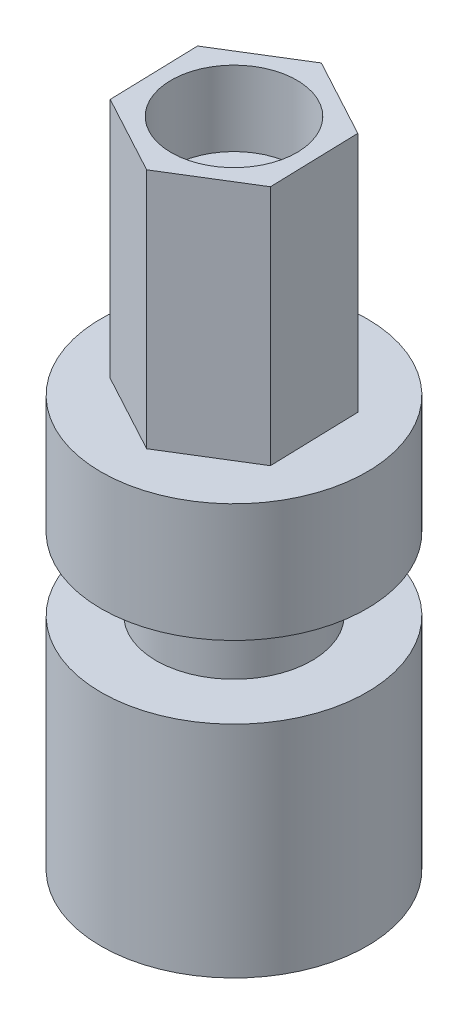
from build123d import *

# Parameters (mm, degrees)
SKETCH1_R           = 3.5
BOSS_EXTRUDE1_DEPTH = 1
SKETCH2_R           = 5.5
BOSS_EXTRUDE2_DEPTH = 8
SKETCH3_R           = 5.5
BOSS_EXTRUDE3_DEPTH = 9
BOSS_EXTRUDE5_DEPTH = 10
SKETCH5_R           = 1.5
CUT_EXTRUDE1_DEPTH  = 30.060282173
SKETCH6_R           = 2.6
CUT_EXTRUDE2_DEPTH  = 3.1
SKETCH7_R           = 8.67620316
SKETCH7_R_2         = 3.225
CUT_EXTRUDE3_DEPTH  = 3
CUT_EXTRUDE4_START  = -3.1
SKETCH8_R           = 2.6
CUT_EXTRUDE4_DEPTH  = 3.1


with BuildPart() as part:
    # Sketch1 → Boss-Extrude1 (new body)
    with BuildSketch(Plane(origin=(0, 0, 0), x_dir=(1, 0, 0), z_dir=(0, 1, 0))):
        with Locations(Location((0, 0, 0), (0, 0, 270))):
            Circle(SKETCH1_R)
    extrude(amount=BOSS_EXTRUDE1_DEPTH)

    # Sketch2 → Boss-Extrude2 (add)
    with BuildSketch(Plane(origin=(0, 1, 0), x_dir=(1, 0, 0), z_dir=(0, 1, 0))):
        with Locations(Location((0, 0, 0), (0, 0, 270))):
            Circle(SKETCH2_R)
    extrude(amount=BOSS_EXTRUDE2_DEPTH)

    # Sketch3 → Boss-Extrude3 (add)
    with BuildSketch(Plane(origin=(0, 9, 0), x_dir=(1, 0, 0), z_dir=(0, 1, 0))):
        with Locations(Location((0, 0, 0), (0, 0, 270))):
            Circle(SKETCH3_R)
    extrude(amount=BOSS_EXTRUDE3_DEPTH)

    # Sketch4 → Boss-Extrude5 (add)
    with BuildSketch(Plane(origin=(0, 18, 0), x_dir=(1, 0, 0), z_dir=(0, 1, 0))):
        Polygon((3.277230323, -1.768406461), (3.170100081, 1.953961483), (-0.107130242, 3.722367944), (-3.277230323, 1.768406461), (-3.170100081, -1.953961483), (0.107130242, -3.722367944), align=None)
    extrude(amount=BOSS_EXTRUDE5_DEPTH)

    # Sketch5 → Cut-Extrude1 (cut, through all)
    with BuildSketch(Plane(origin=(0, 28, 0), x_dir=(1, 0, 0), z_dir=(0, 1, 0))):
        with Locations(Location((0, 0, 0), (0, 0, 270))):
            Circle(SKETCH5_R)
    extrude(amount=-CUT_EXTRUDE1_DEPTH, mode=Mode.SUBTRACT)

    # Sketch6 → Cut-Extrude2 (cut)
    with BuildSketch(Plane.XZ):
        with Locations(Location((0, 0, 0), (0, 0, 270))):
            Circle(SKETCH6_R)
    extrude(amount=-CUT_EXTRUDE2_DEPTH, mode=Mode.SUBTRACT)

    # Sketch7 → Cut-Extrude3 (cut)
    with BuildSketch(Plane(origin=(0, 10.1, 0), x_dir=(1, 0, 0), z_dir=(0, 1, 0))):
        Circle(SKETCH7_R)
        with Locations(Location((0, 0, 0), (0, 0, 270))):
            Circle(SKETCH7_R_2, mode=Mode.SUBTRACT)
    extrude(amount=CUT_EXTRUDE3_DEPTH, mode=Mode.SUBTRACT)

    # Sketch8 → Cut-Extrude4 (cut)
    with BuildSketch(Plane(origin=(0, 28, 0), x_dir=(1, 0, 0), z_dir=(0, 1, 0)).offset(CUT_EXTRUDE4_START)):
        with Locations(Location((0, 0, 0), (0, 0, 90))):
            Circle(SKETCH8_R)
    extrude(amount=CUT_EXTRUDE4_DEPTH, mode=Mode.SUBTRACT)


solid = part.part
